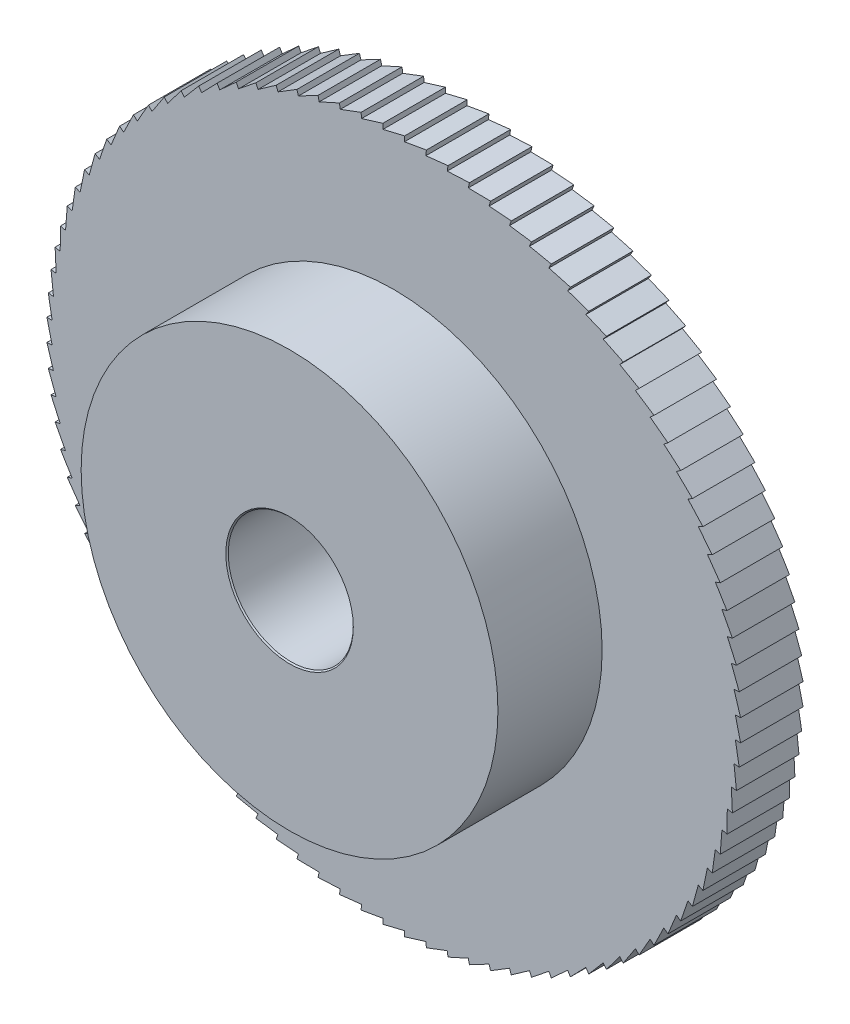
from build123d import *

# Parameters (mm, degrees)
SKETCH1_R           = 32.8
SKETCH1_R_2         = 6
BOSS_EXTRUDE1_DEPTH = 6
BOSS_EXTRUDE2_DEPTH = 6
CIRPATTERN1_COUNT   = 100
BOSS_EXTRUDE3_START = 10
SKETCH3_R           = 20
SKETCH3_R_2         = 6
BOSS_EXTRUDE3_DEPTH = 10
CHAMFER1_SIZE       = 0.12


with BuildPart() as part:
    # Sketch1 → Boss-Extrude1 (new body)
    with BuildSketch(Plane.XY):
        Circle(SKETCH1_R)
        Circle(SKETCH1_R_2, mode=Mode.SUBTRACT)
    extrude(amount=-BOSS_EXTRUDE1_DEPTH)

    # Sketch2 → Boss-Extrude2 (add)
    with BuildSketch(Plane.XY):
        with BuildLine():
            Line((-1.030272898, 32.78381518), (1.045978277, 33.28356846))
            Line((1.045978277, 33.28356846), (1.030272898, 32.78381518))
            ThreePointArc((1.030272898, 32.78381518), (0, 32.8), (-1.030272898, 32.78381518))
        make_face()
    boss_extrude2 = extrude(amount=-BOSS_EXTRUDE2_DEPTH)

    # CirPattern1: Boss-Extrude2 ×100 about axis
    cirpattern1_axis = Axis((0, 0, 0), (0, 0, 1))
    for i in range(1, CIRPATTERN1_COUNT):
        add(boss_extrude2.rotate(cirpattern1_axis, i * 360 / CIRPATTERN1_COUNT))

    # Sketch3 → Boss-Extrude3 (add)
    with BuildSketch(Plane.XY.offset(BOSS_EXTRUDE3_START)):
        Circle(SKETCH3_R)
        Circle(SKETCH3_R_2, mode=Mode.SUBTRACT)
    extrude(amount=-BOSS_EXTRUDE3_DEPTH)

    # Chamfer1
    chamfer1_edges = [part.edges().sort_by_distance(p)[0] for p in [
        (-6, 0, -6),
        (-6, 0, 10),
    ]]
    chamfer(chamfer1_edges, length=CHAMFER1_SIZE)


solid = part.part
